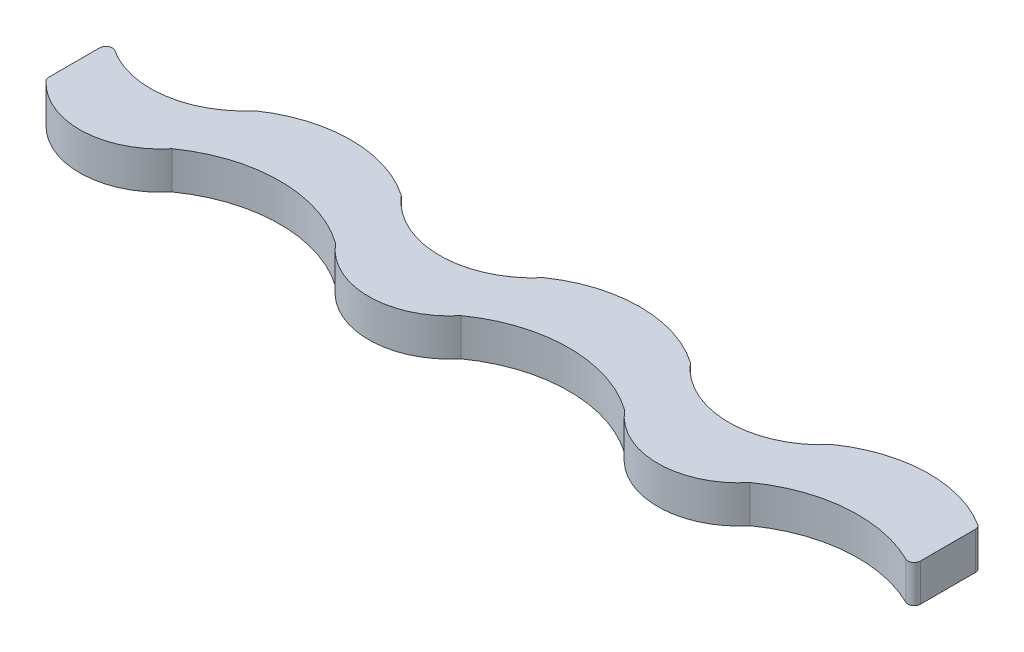
from build123d import *

# Parameters (mm, degrees)
BOSS_EXTRUDE1_DEPTH = 3
SKETCH2_W           = 75.494873271
SKETCH2_H           = 16.574066579
CUT_EXTRUDE1_DEPTH  = 3
FILLET1_R           = 0.5


with BuildPart() as part:
    # Sketch1 → Boss-Extrude1 (new body)
    with BuildSketch(Plane(origin=(0, 0, 0), x_dir=(1, 0, 0), z_dir=(0, 1, 0))):
        with BuildLine():
            ThreePointArc((51.666035076, -4.495071474), (57.875, -2.537392354), (64.083964924, -4.495071474))
            Line((64.083964924, -4.495071474), (64.083964924, -11.181167218))
            ThreePointArc((64.083964924, -11.181167218), (57.875, -9.223488098), (51.666035076, -11.181167218))
            ThreePointArc((51.666035076, -11.181167218), (46.3, -13.686095744), (40.933964924, -11.181167218))
            ThreePointArc((40.933964924, -11.181167218), (34.725, -9.223488098), (28.516035077, -11.181167218))
            ThreePointArc((28.516035077, -11.181167218), (23.15, -13.686095744), (17.783964924, -11.181167218))
            ThreePointArc((17.783964924, -11.181167218), (11.575, -9.223488098), (5.366035077, -11.181167218))
            ThreePointArc((5.366035077, -11.181167218), (0, -13.686095744), (-5.366035076, -11.181167218))
            Line((-5.366035076, -11.181167218), (-5.366035076, -4.495071474))
            ThreePointArc((-5.366035076, -4.495071474), (0, -7), (5.366035076, -4.495071474))
            ThreePointArc((5.366035076, -4.495071474), (11.575, -2.537392354), (17.783964924, -4.495071474))
            ThreePointArc((17.783964924, -4.495071474), (23.15, -7), (28.516035076, -4.495071474))
            ThreePointArc((28.516035076, -4.495071474), (34.725, -2.537392354), (40.933964924, -4.495071474))
            ThreePointArc((40.933964924, -4.495071474), (46.3, -7), (51.666035076, -4.495071474))
        make_face()
    extrude(amount=BOSS_EXTRUDE1_DEPTH)

    # Sketch2 → Cut-Extrude1 (cut)
    with BuildSketch(Plane(origin=(0, 3, 0), x_dir=(1, 0, 0), z_dir=(0, 1, 0))):
        with Locations((29.270514079, -6.984979931)):
            Rectangle(SKETCH2_W, SKETCH2_H)
        with BuildLine():
            Line((63.583964924, -10.267724094), (63.583964924, -4.759291488))
            ThreePointArc((63.583964924, -4.759291488), (57.778030808, -3.037847716), (52.005454008, -4.868038061))
            ThreePointArc((52.005454008, -4.868038061), (46.3, -7.5), (40.594545992, -4.868038061))
            ThreePointArc((40.594545992, -4.868038061), (34.725, -3.037392354), (28.855454008, -4.868038061))
            ThreePointArc((28.855454008, -4.868038061), (23.15, -7.5), (17.444545992, -4.868038061))
            ThreePointArc((17.444545992, -4.868038061), (11.575, -3.037392354), (5.705454008, -4.868038061))
            ThreePointArc((5.705454008, -4.868038061), (0.593454673, -7.476483903), (-4.866035076, -5.707162398))
            Line((-4.866035076, -5.707162398), (-4.866035076, -10.995585579))
            ThreePointArc((-4.866035076, -10.995585579), (0.121449449, -13.184961032), (5.023650974, -10.810769172))
            ThreePointArc((5.023650974, -10.810769172), (11.575, -8.723488098), (18.126349026, -10.810769172))
            ThreePointArc((18.126349026, -10.810769172), (23.15, -13.186095744), (28.173650974, -10.810769172))
            ThreePointArc((28.173650974, -10.810769172), (34.725, -8.723488098), (41.276349026, -10.810769172))
            ThreePointArc((41.276349026, -10.810769172), (46.3, -13.186095744), (51.323650974, -10.810769172))
            ThreePointArc((51.323650974, -10.810769172), (57.373874034, -8.734580825), (63.583964924, -10.267724094))
        make_face(mode=Mode.SUBTRACT)
    extrude(amount=-CUT_EXTRUDE1_DEPTH, mode=Mode.SUBTRACT)

    # Fillet1
    fillet1_edges = [part.edges().sort_by_distance(p)[0] for p in [
        (63.583964924, 1.5, 10.267724094),
        (63.583964924, 1.5, 4.759291488),
        (-4.866035076, 1.5, 5.707162398),
        (-4.866035076, 1.5, 10.995585579),
    ]]
    fillet(fillet1_edges, radius=FILLET1_R)


solid = part.part
